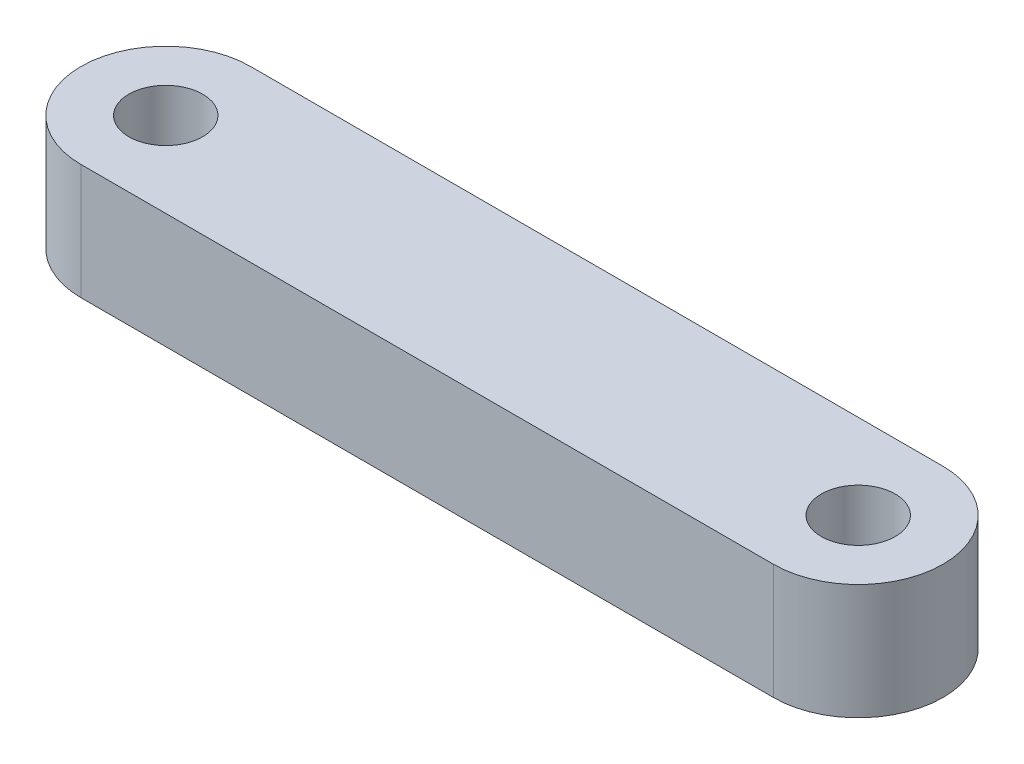
from build123d import *

# Parameters (mm, degrees)
SKETCH1_R           = 1.6
BOSS_EXTRUDE1_DEPTH = 5


with BuildPart() as part:
    # Sketch1 → Boss-Extrude1 (new body)
    with BuildSketch(Plane(origin=(0, 0, 0), x_dir=(1, 0, 0), z_dir=(0, 1, 0))):
        with BuildLine():
            Line((0, -3.675), (-30, -3.675))
            ThreePointArc((-30, -3.675), (-33.675, 0), (-30, 3.675))
            Line((-30, 3.675), (0, 3.675))
            ThreePointArc((0, 3.675), (3.675, 0), (0, -3.675))
        make_face()
        with Locations(Location((-30, 0, 0), (0, 0, 270))):
            Circle(SKETCH1_R, mode=Mode.SUBTRACT)
        with Locations(Location((0, 0, 0), (0, 0, 270))):
            Circle(SKETCH1_R, mode=Mode.SUBTRACT)
    extrude(amount=BOSS_EXTRUDE1_DEPTH)


solid = part.part
